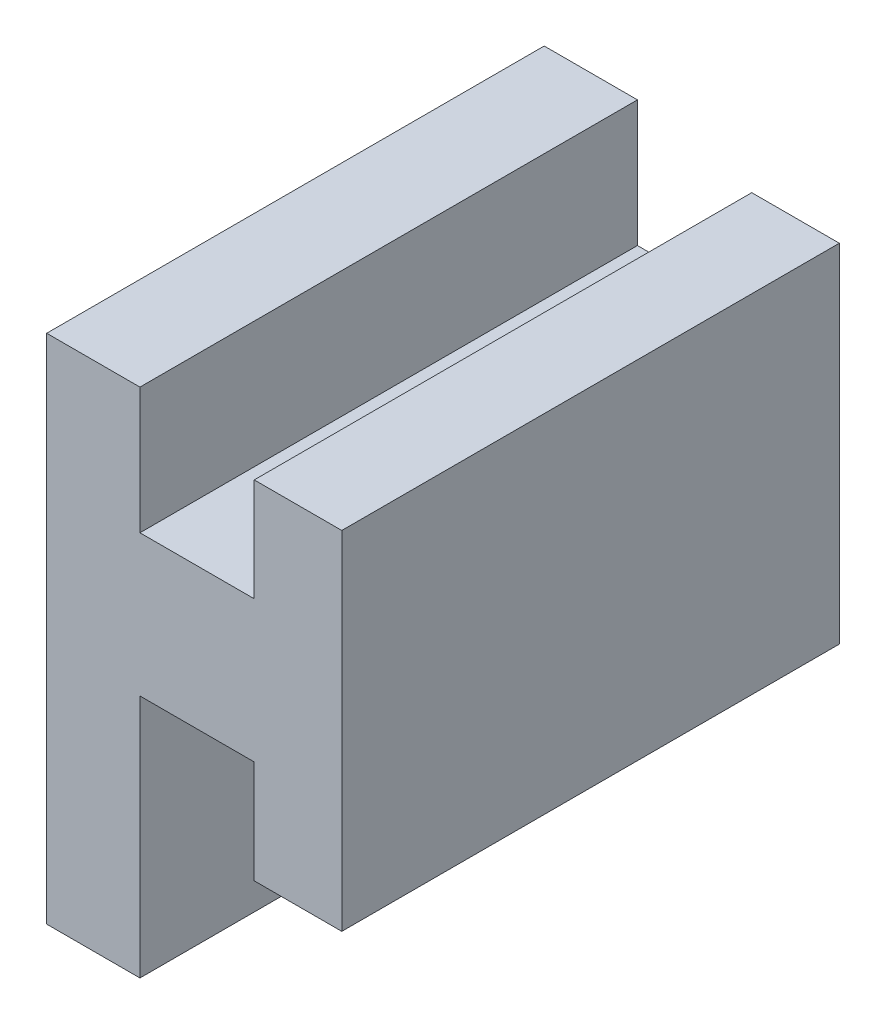
from build123d import *

# Parameters (mm, degrees)
BOSS_EXTRUDE1_DEPTH = 10


with BuildPart() as part:
    # Sketch2 → Boss-Extrude1 (new body)
    with BuildSketch(Plane.XY):
        Polygon((-32.12, -9.653023841), (-32.12, -12.189217722), (-29.822797906, -12.189217722), (-29.822797906, -10.12), (-28.062797906, -10.12), (-28.062797906, -17.098869174), (-29.822797906, -17.098869174), (-29.822797906, -15.029651452), (-32.12, -15.029651452), (-32.12, -19.938982177), (-33.994430759, -19.938982177), (-33.994430759, -9.653023841), align=None)
    extrude(amount=-BOSS_EXTRUDE1_DEPTH)


solid = part.part
